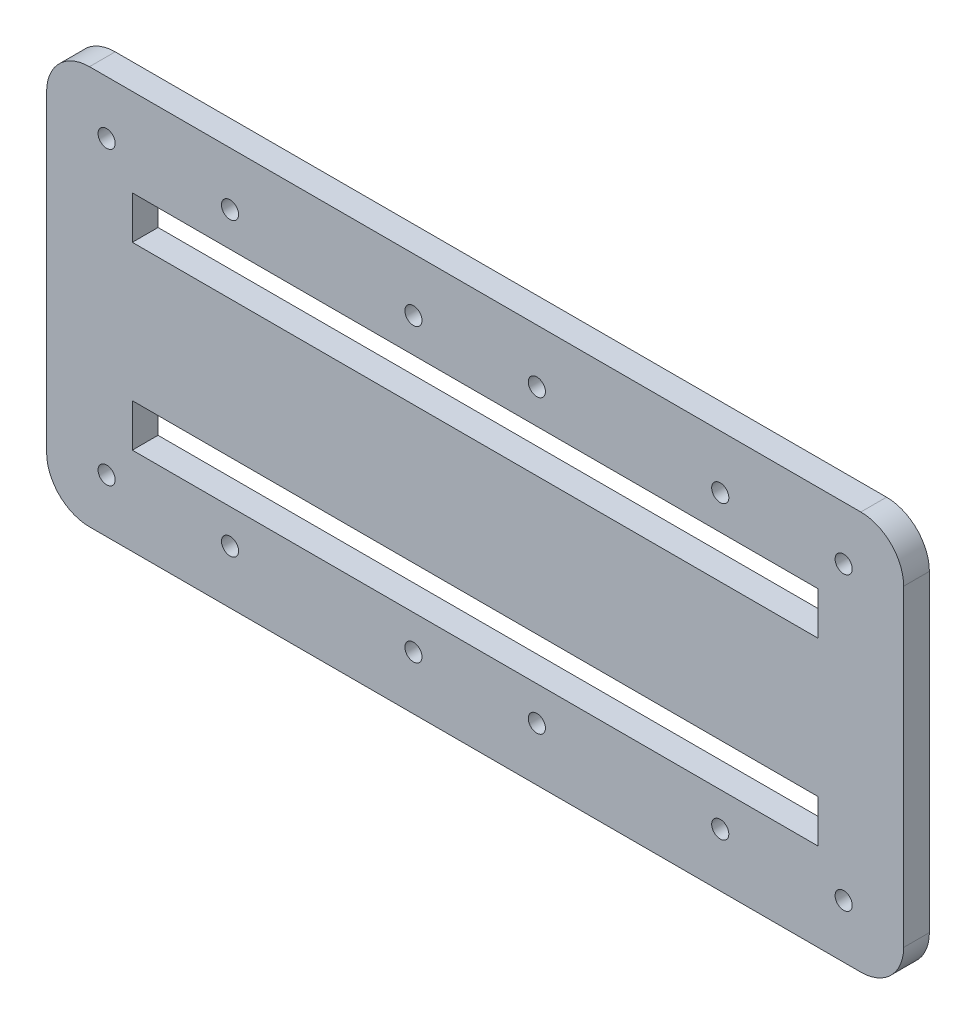
from build123d import *

# Parameters (mm, degrees)
SKETCH_1_W          = 200
SKETCH_1_H          = 93
SKETCH_1_W_2        = 160
SKETCH_1_H_2        = 10
EXTRUDE_1_DEPTH     = 6
SKETCH_2_R          = 2
CUT_EXTRUDE_1_DEPTH = 6
FILLET_1_R          = 10


with BuildPart() as part:
    # 草圖1 → 填料-伸長1 (new body)
    with BuildSketch(Plane.XY):
        with Locations((-170.830010195, 101.23957139)):
            Rectangle(SKETCH_1_W, SKETCH_1_H)
        with Locations((-170.830010195, 122.23957139)):
            Rectangle(SKETCH_1_W_2, SKETCH_1_H_2, mode=Mode.SUBTRACT)
        with Locations((-170.830010195, 80.23957139)):
            Rectangle(SKETCH_1_W_2, SKETCH_1_H_2, mode=Mode.SUBTRACT)
    extrude(amount=EXTRUDE_1_DEPTH)

    # 草圖2 → 除料-伸長1 (cut)
    with BuildSketch(Plane(origin=(0, 0, 0), x_dir=(-1, 0, 0), z_dir=(0, 0, -1))):
        with Locations((84.830010195, 135.23957139)):
            Circle(SKETCH_2_R)
        with Locations((113.630010195, 135.23957139)):
            Circle(SKETCH_2_R)
        with Locations((156.430010195, 135.23957139)):
            Circle(SKETCH_2_R)
        with Locations((185.230010195, 135.23957139)):
            Circle(SKETCH_2_R)
        with Locations((228.030010195, 135.23957139)):
            Circle(SKETCH_2_R)
        with Locations((256.830010195, 135.23957139)):
            Circle(SKETCH_2_R)
        with Locations((84.830010195, 67.23957139)):
            Circle(SKETCH_2_R)
        with Locations((113.630010195, 67.23957139)):
            Circle(SKETCH_2_R)
        with Locations((156.430010195, 67.23957139)):
            Circle(SKETCH_2_R)
        with Locations((185.230010195, 67.23957139)):
            Circle(SKETCH_2_R)
        with Locations((228.030010195, 67.23957139)):
            Circle(SKETCH_2_R)
        with Locations((256.830010195, 67.23957139)):
            Circle(SKETCH_2_R)
    extrude(amount=-CUT_EXTRUDE_1_DEPTH, mode=Mode.SUBTRACT)

    # 圓角1
    fillet_1_edges = [part.edges().sort_by_distance(p)[0] for p in [
        (-70.830010195, 54.73957139, 3),
        (-270.830010195, 54.73957139, 3),
        (-270.830010195, 147.73957139, 3),
        (-70.830010195, 147.73957139, 3),
    ]]
    fillet(fillet_1_edges, radius=FILLET_1_R)


solid = part.part
